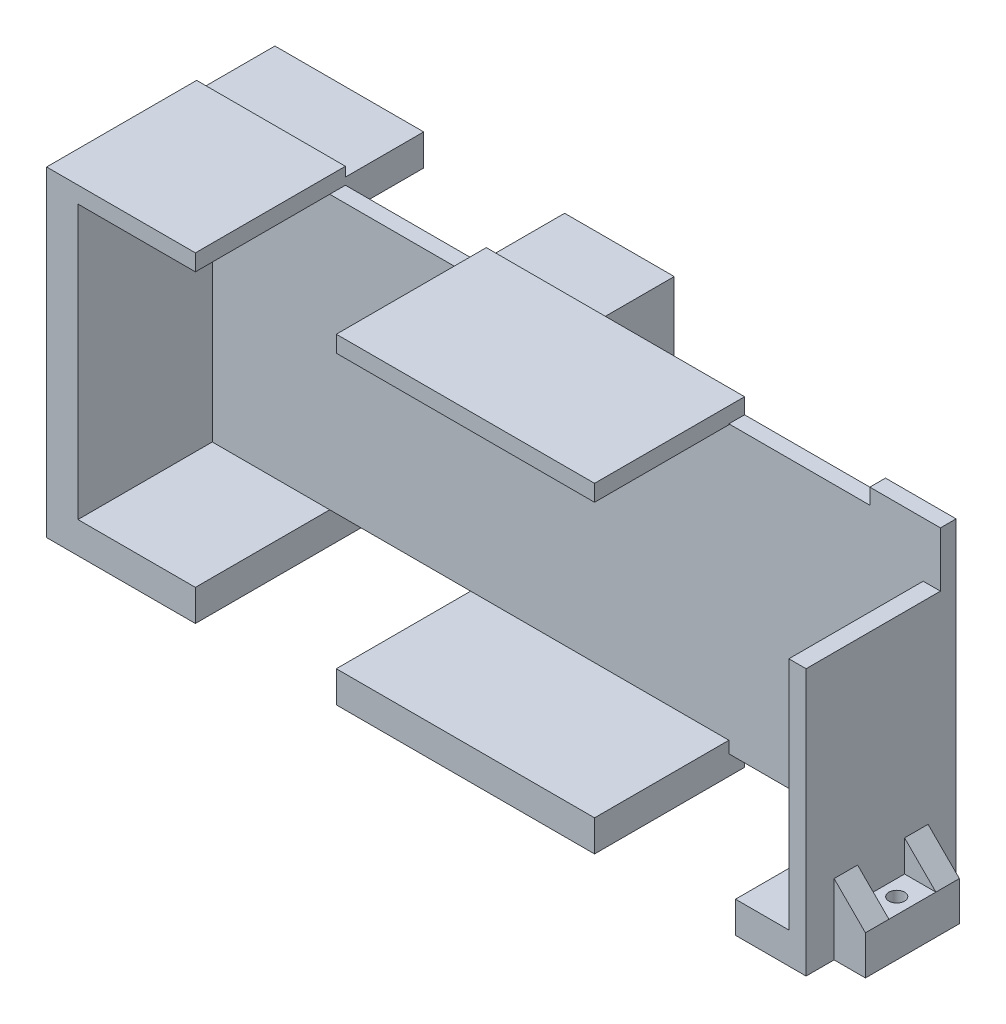
from build123d import *

# Parameters (mm, degrees)
SKETCH1_W            = 64.77
SKETCH1_H            = 50.546
SKETCH1_W_2          = 58.674
SKETCH1_H_2          = 40.386
BOSS_EXTRUDE1_DEPTH  = 12.7
BOSS_EXTRUDE2_DEPTH  = 2.54
BOSS_EXTRUDE3_DEPTH  = 21.7932
SKETCH6_W            = 22.86
SKETCH6_H            = 2.667
SKETCH6_H_2          = 5.08
CUT_EXTRUDE1_DEPTH   = 102.661620763
SKETCH7_W            = 22.86
SKETCH7_H            = 5.08
SKETCH7_H_2          = 1.143
CUT_EXTRUDE2_DEPTH   = 12.7
SKETCH10_W           = 14.097
SKETCH10_H           = 6.35
BOSS_EXTRUDE4_DEPTH  = 5.08
BOSS_EXTRUDE5_DEPTH  = 3.81
SKETCH12_R           = 1.27
CUT_EXTRUDE3_DEPTH   = 109.200389682
BOSS_EXTRUDE7_DEPTH  = 3.81
SKETCH14_W           = 15.24
SKETCH14_H           = 6.35
BOSS_EXTRUDE8_DEPTH  = 5.08
SKETCH15_R           = 1.27
CUT_EXTRUDE4_DEPTH   = 113.497597873
BOSS_EXTRUDE9_DEPTH  = 3.81
BOSS_EXTRUDE10_DEPTH = 3.81


with BuildPart() as part:
    # Sketch1 → Boss-Extrude1 (new body)
    with BuildSketch(Plane.XY):
        Rectangle(SKETCH1_W, SKETCH1_H)
        Rectangle(SKETCH1_W_2, SKETCH1_H_2, mode=Mode.SUBTRACT)
    extrude(amount=BOSS_EXTRUDE1_DEPTH)

    # Sketch3 → Boss-Extrude2 (add)
    with BuildSketch(Plane.XY.offset(12.7)):
        Polygon((79.354012503, -25.273), (79.354012503, -22.098), (56.494012503, -22.098), (56.494012503, -25.273), (-32.385, -25.273), (-32.385, 26.797), (56.494012503, 26.797), (56.494012503, 24.257), (79.354012503, 24.257), (79.354012503, 26.797), (90.805, 26.797), (90.805, -25.273), align=None)
    extrude(amount=BOSS_EXTRUDE2_DEPTH)

    # Sketch5 → Boss-Extrude3 (add)
    with BuildSketch(Plane.XY.offset(15.24)):
        Polygon((-32.385, 26.797), (-32.385, -25.273), (56.494012503, -25.273), (56.494012503, -20.193), (-27.305, -20.193), (-27.305, 24.13), (56.494012503, 24.13), (56.494012503, 26.797), align=None)
        Polygon((79.354012503, -20.193), (79.354012503, -25.273), (90.805, -25.273), (90.805, 17.907), (88.011, 17.907), (88.011, -20.193), align=None)
    extrude(amount=BOSS_EXTRUDE3_DEPTH)

    # Sketch6 → Cut-Extrude1 (cut, through all)
    with BuildSketch(Plane.XY.offset(37.0332)):
        with Locations((3.175, 25.4635)):
            Rectangle(SKETCH6_W, SKETCH6_H)
        with Locations((3.175, -22.733)):
            Rectangle(SKETCH6_W, SKETCH6_H_2)
    extrude(amount=-CUT_EXTRUDE1_DEPTH, mode=Mode.SUBTRACT)

    # Sketch7 → Cut-Extrude2 (cut)
    with BuildSketch(Plane(origin=(0, 0, 0), x_dir=(-1, 0, 0), z_dir=(0, 0, -1))):
        with Locations((-3.175, 22.733)):
            Rectangle(SKETCH7_W, SKETCH7_H)
        with Locations((-3.175, -20.7645)):
            Rectangle(SKETCH7_W, SKETCH7_H_2)
    extrude(amount=-CUT_EXTRUDE2_DEPTH, mode=Mode.SUBTRACT)

    # Sketch10 → Boss-Extrude4 (add)
    with BuildSketch(Plane.ZY.offset(32.385)):
        with Locations((18.5166, -22.098)):
            Rectangle(SKETCH10_W, SKETCH10_H)
    extrude(amount=BOSS_EXTRUDE4_DEPTH)

    # Sketch11 → Boss-Extrude5 (add)
    with BuildSketch(Plane.XY.offset(25.5651)):
        Polygon((-37.465, -18.923), (-32.385, -18.923), (-32.385, -13.843), align=None)
    extrude(amount=-BOSS_EXTRUDE5_DEPTH)

    # Sketch12 → Cut-Extrude3 (cut, through all)
    with BuildSketch(Plane(origin=(0, -18.923, 0), x_dir=(1, 0, 0), z_dir=(0, 1, 0))):
        with Locations(Location((-34.925, -18.5166, 0), (0, 0, 270))):
            Circle(SKETCH12_R)
    extrude(amount=-CUT_EXTRUDE3_DEPTH, mode=Mode.SUBTRACT)

    # Sketch13 → Boss-Extrude7 (add)
    with BuildSketch(Plane(origin=(0, 0, 11.4681), x_dir=(-1, 0, 0), z_dir=(0, 0, -1))):
        Polygon((32.385, -13.843), (32.385, -18.923), (37.465, -18.923), align=None)
    extrude(amount=-BOSS_EXTRUDE7_DEPTH)

    # Sketch14 → Boss-Extrude8 (add)
    with BuildSketch(Plane(origin=(90.805, 0, 0), x_dir=(0, 0, -1), z_dir=(1, 0, 0))):
        with Locations((-24.8666, -22.098)):
            Rectangle(SKETCH14_W, SKETCH14_H)
    extrude(amount=BOSS_EXTRUDE8_DEPTH)

    # Sketch15 → Cut-Extrude4 (cut, through all)
    with BuildSketch(Plane(origin=(0, -18.923, 0), x_dir=(1, 0, 0), z_dir=(0, 1, 0))):
        with Locations(Location((93.345, -24.8666, 0), (0, 0, 270))):
            Circle(SKETCH15_R)
    extrude(amount=-CUT_EXTRUDE4_DEPTH, mode=Mode.SUBTRACT)

    # Sketch17 → Boss-Extrude9 (add)
    with BuildSketch(Plane.XY.offset(32.4866)):
        Polygon((95.885, -18.923), (90.805, -18.923), (90.805, -13.843), align=None)
    extrude(amount=-BOSS_EXTRUDE9_DEPTH)

    # Sketch18 → Boss-Extrude10 (add)
    with BuildSketch(Plane(origin=(0, 0, 17.2466), x_dir=(-1, 0, 0), z_dir=(0, 0, -1))):
        Polygon((-95.885, -18.923), (-90.805, -18.923), (-90.805, -13.843), align=None)
    extrude(amount=-BOSS_EXTRUDE10_DEPTH)


solid = part.part
